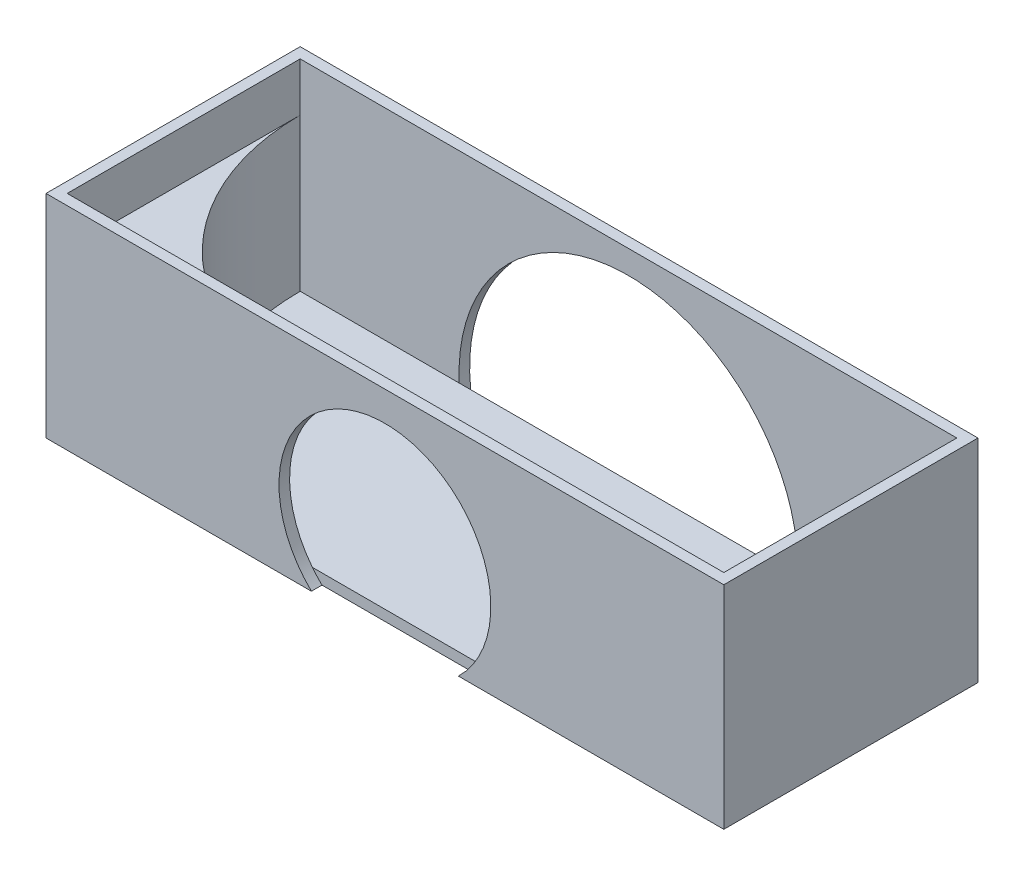
from build123d import *

# Parameters (mm, degrees)
SKETCH1_W                         = 203.2
SKETCH1_H                         = 76.2
BOSS_EXTRUDE1_DEPTH               = 63.5
SHELL1_T                          = -3.175
CUT_EXTRUDE1_BACK_MOUSEHOLE_DEPTH = 3.175
SKETCH3_R                         = 31.75
CUT_EXTRUDE2_DEPTH                = 3.175
BOSS_EXTRUDE2_DEPTH               = 45.72


with BuildPart() as part:
    # Sketch1 → Boss-Extrude1 (new body)
    with BuildSketch(Plane(origin=(0, 0, 0), x_dir=(1, 0, 0), z_dir=(0, 1, 0))):
        Rectangle(SKETCH1_W, SKETCH1_H)
    extrude(amount=BOSS_EXTRUDE1_DEPTH)

    # Shell1
    shell1_openings = [part.faces().sort_by_distance(p)[0] for p in [
        (0, 63.5, 0),
    ]]
    offset(amount=SHELL1_T, openings=shell1_openings, kind=Kind.INTERSECTION)

    # Sketch2 → Cut-Extrude1 BACK MOUSEHOLE (cut)
    with BuildSketch(Plane(origin=(0, 0, -38.1), x_dir=(-1, 0, 0), z_dir=(0, 0, -1))):
        with BuildLine():
            Line((-50.482186023, 0), (50.482186023, 0))
            ThreePointArc((50.482186023, 0), (0, 56.473525739), (-50.482186023, 0))
        make_face()
    extrude(amount=-CUT_EXTRUDE1_BACK_MOUSEHOLE_DEPTH, mode=Mode.SUBTRACT)

    # Sketch3 → Cut-Extrude2 (cut)
    with BuildSketch(Plane.XY.offset(38.1)):
        with Locations((0, 22.86)):
            Circle(SKETCH3_R)
    extrude(amount=-CUT_EXTRUDE2_DEPTH, mode=Mode.SUBTRACT)


with BuildPart() as body_2:
    # Sketch4 → Boss-Extrude2 (new body)
    with BuildSketch(Plane(origin=(0, 3.175, 0), x_dir=(1, 0, 0), z_dir=(0, 1, 0))):
        with BuildLine():
            Line((-98.425, 34.925), (-98.425, -34.925))
            Line((-98.425, -34.925), (-39.500064478, -34.925))
            ThreePointArc((-39.500064478, -34.925), (-81.726241757, -10.767369511), (-98.425, 34.925))
        make_face()
    extrude(amount=BOSS_EXTRUDE2_DEPTH)


solid = Compound([part.part, body_2.part])
